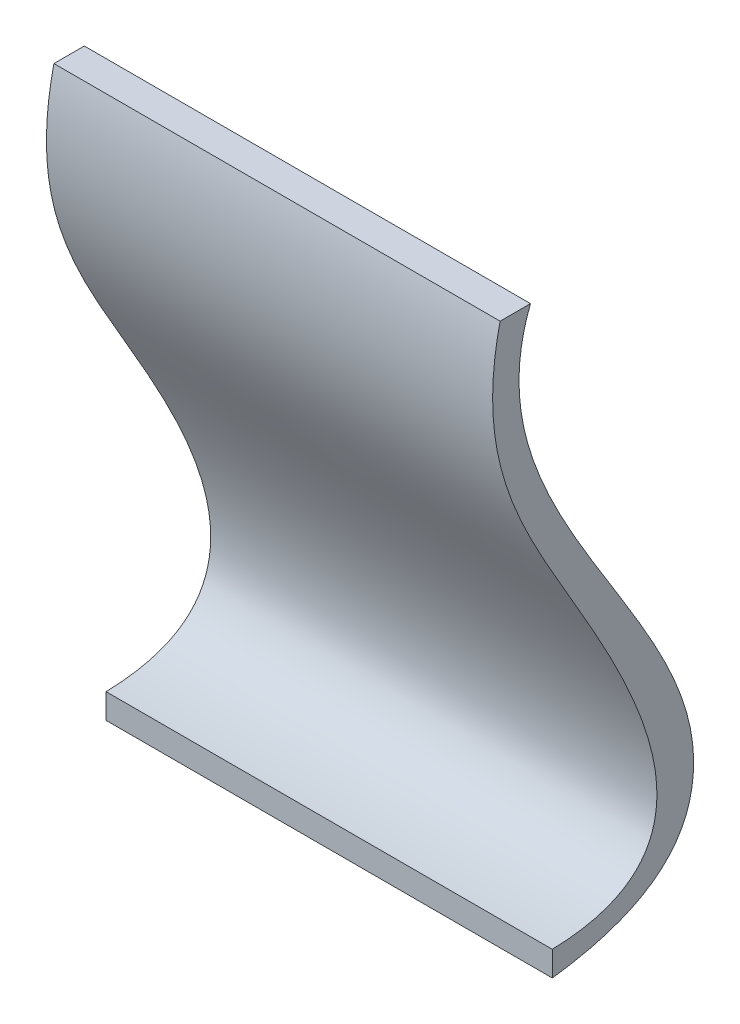
from build123d import *

# Parameters (mm, degrees)
RESSALTO_EXTRUS_O1_DEPTH = 3


with BuildPart() as part:
    # Esboço1 → Ressalto-extrusão1 (new body)
    with BuildSketch(Plane(origin=(0, 0, 0), x_dir=(0, 0, -1), z_dir=(1, 0, 0))):
        with BuildLine():
            add(Edge.make_bspline(
                [(0, 0.167275677), (1.000719121, 0.192327669), (0.382421828, 2.06614201), (-0.570185681, 3.049397899), (-0.35081742, 4)],
                knots=[0, 0, 0, 0, 0.429244299, 1, 1, 1, 1], degree=3))
            Line((-0.35081742, 4), (-0.146433982, 4))
            add(Edge.make_bspline(
                [(0, 0), (0.709176752, 0.088703515), (1.563578973, 1.302898104), (-0.593062367, 2.870769037), (-0.146433982, 4)],
                knots=[0, 0, 0, 0, 0.240929586, 1, 1, 1, 1], degree=3))
            Line((0, 0), (0, 0.167275677))
        make_face()
    extrude(amount=RESSALTO_EXTRUS_O1_DEPTH)


solid = part.part
